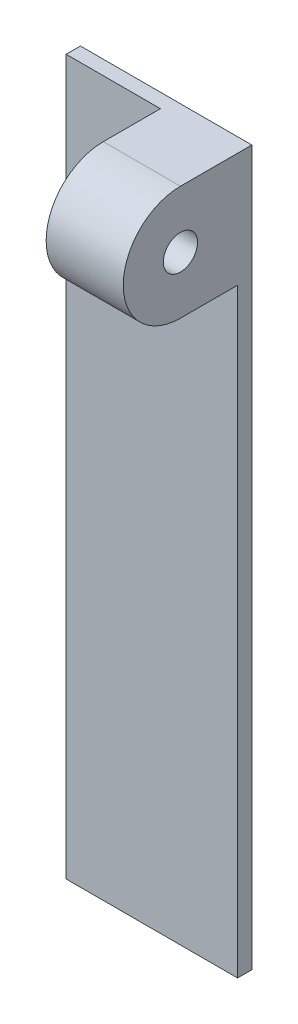
from build123d import *

# Parameters (mm, degrees)
SKETCH1_W           = 60
SKETCH1_H           = 250
BOSS_EXTRUDE1_DEPTH = 5
BOSS_EXTRUDE2_DEPTH = 27
SKETCH3_R           = 6
CUT_EXTRUDE1_DEPTH  = 146.773797371


with BuildPart() as part:
    # Sketch1 → Boss-Extrude1 (new body)
    with BuildSketch(Plane.XY):
        Rectangle(SKETCH1_W, SKETCH1_H)
    extrude(amount=BOSS_EXTRUDE1_DEPTH)

    # Sketch2 → Boss-Extrude2 (add)
    with BuildSketch(Plane(origin=(30, 0, 0), x_dir=(0, 0, -1), z_dir=(1, 0, 0))):
        with BuildLine():
            Line((-5, 125), (-5, 85))
            Line((-5, 85), (-25, 85))
            ThreePointArc((-25, 85), (-45, 105), (-25, 125))
            Line((-25, 125), (-5, 125))
        make_face()
    extrude(amount=-BOSS_EXTRUDE2_DEPTH)

    # Sketch3 → Cut-Extrude1 (cut, through all)
    with BuildSketch(Plane(origin=(30, 0, 0), x_dir=(0, 0, -1), z_dir=(1, 0, 0))):
        with Locations((-25, 105)):
            Circle(SKETCH3_R)
    extrude(amount=-CUT_EXTRUDE1_DEPTH, mode=Mode.SUBTRACT)


solid = part.part
